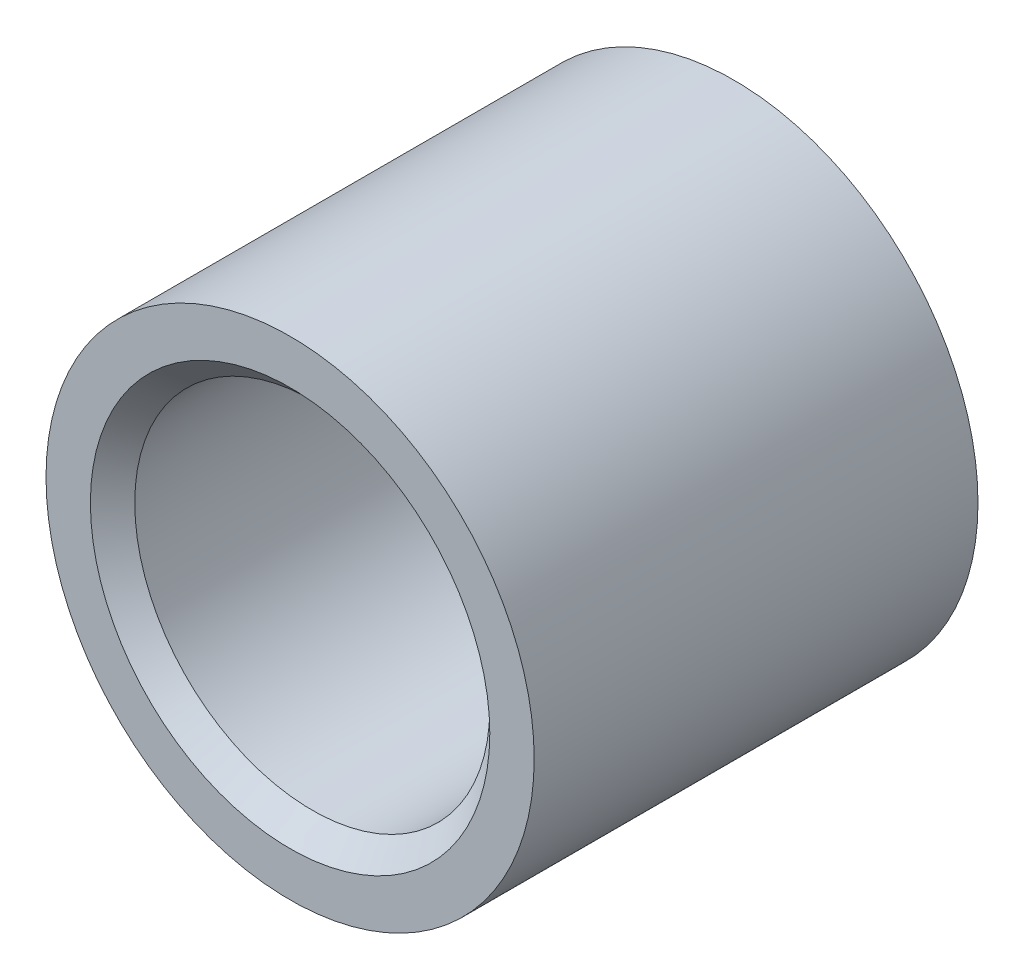
from build123d import *

# Parameters (mm, degrees)
SKETCH1_R           = 13.97
SKETCH1_R_2         = 10.16
BOSS_EXTRUDE1_DEPTH = 25.4
CHAMFER1_SIZE       = 1.27


with BuildPart() as part:
    # Sketch1 → Boss-Extrude1 (new body)
    with BuildSketch(Plane.XY):
        Circle(SKETCH1_R)
        Circle(SKETCH1_R_2, mode=Mode.SUBTRACT)
    extrude(amount=BOSS_EXTRUDE1_DEPTH)

    # Chamfer1
    chamfer1_edges = [part.edges().sort_by_distance(p)[0] for p in [
        (-10.16, 0, 0),
        (-10.16, 0, 25.4),
    ]]
    chamfer(chamfer1_edges, length=CHAMFER1_SIZE)


solid = part.part
